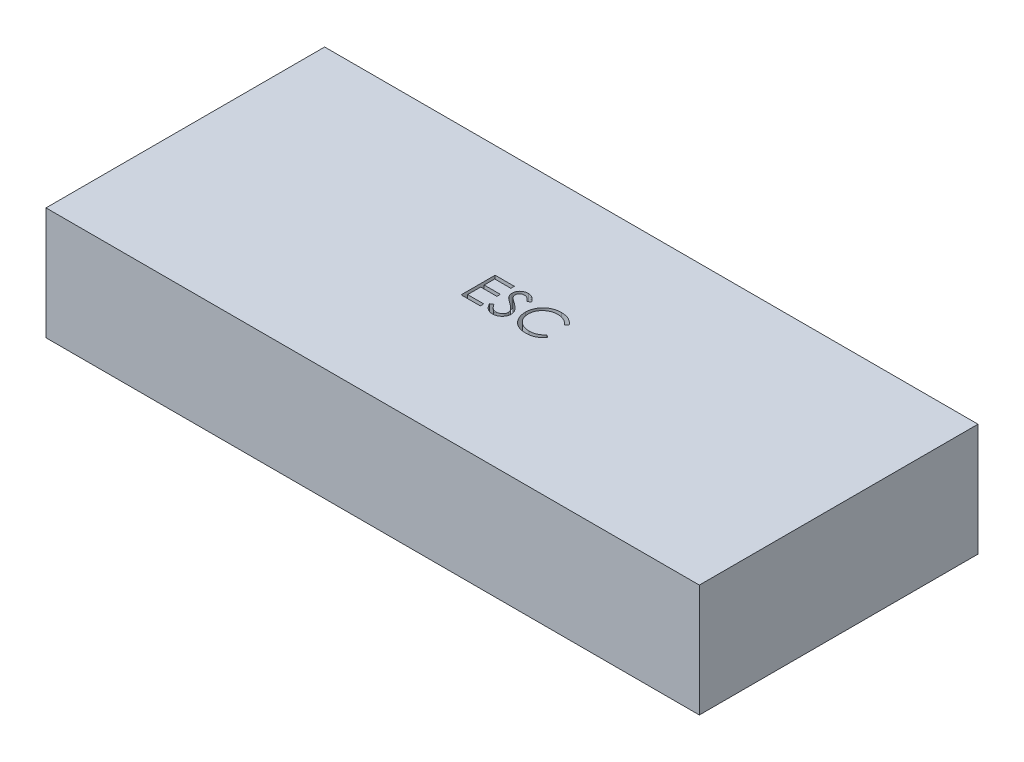
from build123d import *

# Parameters (mm, degrees)
SKETCH1_W           = 60.96
SKETCH1_H           = 25.999948
BOSS_EXTRUDE1_DEPTH = 10.5000044
CUT_EXTRUDE1_DEPTH  = 1.27


with BuildPart() as part:
    # Sketch1 → Boss-Extrude1 (new body)
    with BuildSketch(Plane(origin=(0, 0, 0), x_dir=(1, 0, 0), z_dir=(0, 1, 0))):
        Rectangle(SKETCH1_W, SKETCH1_H)
    extrude(amount=BOSS_EXTRUDE1_DEPTH)

    # Sketch2 → Cut-Extrude1 (cut)
    with BuildSketch(Plane(origin=(0, 10.5000044, 0), x_dir=(1, 0, 0), z_dir=(0, 1, 0))):
        Polygon((-4.08647315, 2.511822677), (-2.295447509, 2.511822677), (-2.295447509, 2.186181651), (-3.801537253, 2.186181651), (-3.801537253, 1.209258574), (-2.295447509, 1.209258574), (-2.295447509, 0.883617549), (-3.801537253, 0.883617549), (-3.801537253, -0.337536297), (-2.295447509, -0.337536297), (-2.295447509, -0.663177323), (-4.08647315, -0.663177323), align=None)
        with BuildLine():
            Line((-2.05121674, -0.050692347), (-1.782817301, 0.110220113))
            add(Edge.make_bspline(
                [(-1.782817301, 0.110220113), (-1.757854329, 0.068433135), (-1.710026237, -0.011629102), (-1.63024179, -0.119813181), (-1.54757122, -0.211763138), (-1.461402325, -0.28694406), (-1.372261072, -0.346134122), (-1.279565538, -0.388046146), (-1.183628095, -0.414186353), (-1.118337557, -0.417361431), (-1.085741981, -0.418946554)],
                knots=[0, 0, 0, 0, 1.272034388, 2.437168799, 3.508375237, 4.49857839, 5.41946034, 6.295179144, 7.148887113, 8, 8, 8, 8], degree=3))
            add(Edge.make_bspline(
                [(-1.085741981, -0.418946554), (-1.057904614, -0.418171244), (-1.00271697, -0.41663419), (-0.921471221, -0.401865176), (-0.842566301, -0.379175602), (-0.767628465, -0.3466809), (-0.697691729, -0.307366702), (-0.636362798, -0.259881241), (-0.583343824, -0.206717041), (-0.539974127, -0.147405632), (-0.506700095, -0.083617933), (-0.481125862, -0.018144035), (-0.466933545, 0.050044595), (-0.464795633, 0.095955515), (-0.46371674, 0.11912436)],
                knots=[0, 0, 0, 0, 1.095163259, 2.171163733, 3.241058638, 4.321873601, 5.38011039, 6.391990106, 7.366004449, 8.327778327, 9.272591725, 10.192022065, 11.087607919, 12, 12, 12, 12], degree=3))
            add(Edge.make_bspline(
                [(-0.46371674, 0.11912436), (-0.465054151, 0.145559273), (-0.467772911, 0.19929759), (-0.490752182, 0.278581561), (-0.526901141, 0.357042678), (-0.560250111, 0.405575969), (-0.577563896, 0.430772997)],
                knots=[0, 0, 0, 0, 0.938893495, 1.908633276, 2.914225137, 4, 4, 4, 4], degree=3))
            add(Edge.make_bspline(
                [(-0.577563896, 0.430772997), (-0.591779381, 0.44895833), (-0.621623015, 0.487136162), (-0.672928759, 0.54396434), (-0.733132306, 0.602582477), (-0.800173388, 0.665228907), (-0.876494118, 0.72898998), (-0.959704078, 0.796906203), (-1.051927721, 0.866394777), (-1.11660655, 0.912997033), (-1.149979761, 0.937043029)],
                knots=[0, 0, 0, 0, 0.722233717, 1.516239348, 2.393582979, 3.351407094, 4.387010283, 5.505090956, 6.712668013, 8, 8, 8, 8], degree=3))
            add(Edge.make_bspline(
                [(-1.149979761, 0.937043029), (-1.183384386, 0.960836105), (-1.247251486, 1.006326655), (-1.336567485, 1.073840112), (-1.416436391, 1.135565623), (-1.486503213, 1.192084262), (-1.546737133, 1.243403696), (-1.597612799, 1.289031113), (-1.637834204, 1.330200486), (-1.660200338, 1.356907989), (-1.670242181, 1.368898999)],
                knots=[0, 0, 0, 0, 1.452282411, 2.77665338, 3.964542531, 5.026858415, 5.96415736, 6.766646006, 7.446254459, 8, 8, 8, 8], degree=3))
            add(Edge.make_bspline(
                [(-1.670242181, 1.368898999), (-1.68427799, 1.387587082), (-1.711881292, 1.424339707), (-1.748317597, 1.481784399), (-1.779286694, 1.540588361), (-1.803563953, 1.60090961), (-1.824007523, 1.661901295), (-1.837757931, 1.724359211), (-1.846367984, 1.788003101), (-1.847249715, 1.83083249), (-1.847691099, 1.852272396)],
                knots=[0, 0, 0, 0, 1.068054152, 2.10047183, 3.106115577, 4.101338837, 5.06977816, 6.043150881, 7.020423561, 8, 8, 8, 8], degree=3))
            add(Edge.make_bspline(
                [(-1.847691099, 1.852272396), (-1.846507088, 1.885863692), (-1.844164374, 1.952328293), (-1.824351904, 2.049420546), (-1.793080065, 2.142118224), (-1.749269702, 2.229503599), (-1.692793389, 2.30930131), (-1.627437398, 2.382429259), (-1.549594122, 2.443905044), (-1.464184242, 2.49761884), (-1.37069739, 2.539661215), (-1.272734214, 2.571375818), (-1.170139012, 2.589345645), (-1.100649026, 2.591924439), (-1.065389416, 2.593232933)],
                knots=[0, 0, 0, 0, 1.005424448, 1.989358655, 2.955360095, 3.929531133, 4.905563448, 5.876582895, 6.856512386, 7.866279853, 8.892233794, 9.918561126, 10.94386622, 12, 12, 12, 12], degree=3))
            add(Edge.make_bspline(
                [(-1.065389416, 2.593232933), (-1.027975125, 2.591942476), (-0.953570042, 2.589376168), (-0.844123968, 2.567062693), (-0.738749604, 2.530141369), (-0.653983214, 2.488241658), (-0.587641351, 2.446393874), (-0.537047515, 2.40827589), (-0.485778114, 2.364392756), (-0.433419592, 2.314627583), (-0.380859137, 2.258523744), (-0.327316434, 2.196465476), (-0.272666276, 2.128832029), (-0.237509174, 2.080549804), (-0.219485971, 2.055798037)],
                knots=[0, 0, 0, 0, 1.286793592, 2.559021753, 3.825965368, 5.121522368, 5.803751409, 6.523245864, 7.299691795, 8.125521123, 9.008227632, 9.944561021, 10.946284179, 12, 12, 12, 12], degree=3))
            Line((-0.219485971, 2.055798037), (-0.47707311, 1.860540626))
            add(Edge.make_bspline(
                [(-0.47707311, 1.860540626), (-0.492626921, 1.880578223), (-0.522579922, 1.919165952), (-0.568054528, 1.973205645), (-0.610915802, 2.022569166), (-0.653143664, 2.065445389), (-0.692507887, 2.104182324), (-0.730714061, 2.137347247), (-0.767212366, 2.165265108), (-0.813219849, 2.195058909), (-0.871020922, 2.224592309), (-0.943578323, 2.249583258), (-1.019403015, 2.264601064), (-1.071046324, 2.266586698), (-1.097190298, 2.267591908)],
                knots=[0, 0, 0, 0, 1.181633172, 2.275549214, 3.290209073, 4.226197932, 5.078386478, 5.862611352, 6.581680152, 7.217281963, 8.414376989, 9.595101626, 10.782541182, 12, 12, 12, 12], degree=3))
            add(Edge.make_bspline(
                [(-1.097190298, 2.267591908), (-1.129989429, 2.266492723), (-1.193239463, 2.264373048), (-1.283037749, 2.241222776), (-1.363858667, 2.204772088), (-1.433302779, 2.153686358), (-1.491121323, 2.093160886), (-1.53294556, 2.023511496), (-1.558118924, 1.946601745), (-1.561190763, 1.892951814), (-1.562755202, 1.865628767)],
                knots=[0, 0, 0, 0, 1.14458467, 2.207223713, 3.21896685, 4.227309161, 5.202851033, 6.127160689, 7.046193047, 8, 8, 8, 8], degree=3))
            add(Edge.make_bspline(
                [(-1.562755202, 1.865628767), (-1.56239858, 1.848618497), (-1.561684753, 1.814570142), (-1.551729043, 1.764267781), (-1.538938938, 1.714092494), (-1.518670979, 1.664269866), (-1.490689882, 1.613928554), (-1.453945901, 1.562201692), (-1.407669539, 1.508633356), (-1.372221107, 1.473792382), (-1.353505402, 1.455397396)],
                knots=[0, 0, 0, 0, 0.858281714, 1.717966888, 2.583508476, 3.4729293, 4.427298488, 5.488583878, 6.674047936, 8, 8, 8, 8], degree=3))
            add(Edge.make_bspline(
                [(-1.353505402, 1.455397396), (-1.346555443, 1.449195237), (-1.33004393, 1.434460327), (-1.299857912, 1.410337329), (-1.259995517, 1.380580529), (-1.211497663, 1.343762035), (-1.153470127, 1.301052423), (-1.08590653, 1.252997789), (-1.009559997, 1.198038122), (-0.955383687, 1.159613782), (-0.926737574, 1.139296635)],
                knots=[0, 0, 0, 0, 0.420754252, 0.999615792, 1.744751191, 2.668019286, 3.750313428, 4.999500688, 6.413464383, 8, 8, 8, 8], degree=3))
            add(Edge.make_bspline(
                [(-0.926737574, 1.139296635), (-0.892278924, 1.114221973), (-0.825554524, 1.065668366), (-0.730615148, 0.992719856), (-0.644532908, 0.921375095), (-0.567005573, 0.852089694), (-0.497267235, 0.78538921), (-0.436091588, 0.720471182), (-0.382855292, 0.657800698), (-0.325542715, 0.577452719), (-0.266979551, 0.478772735), (-0.216686183, 0.357870333), (-0.184973968, 0.236497956), (-0.18082695, 0.154921469), (-0.178780843, 0.114672236)],
                knots=[0, 0, 0, 0, 1.163667725, 2.253281268, 3.268753668, 4.215851969, 5.092017293, 5.902905408, 6.650798638, 7.335211899, 8.59617414, 9.77448103, 10.901945474, 12, 12, 12, 12], degree=3))
            add(Edge.make_bspline(
                [(-0.178780843, 0.114672236), (-0.179376961, 0.086207576), (-0.180557621, 0.029831021), (-0.194129307, -0.05295037), (-0.214013575, -0.13335123), (-0.243983066, -0.210377739), (-0.280561931, -0.28543906), (-0.326977027, -0.356566227), (-0.380777569, -0.42533346), (-0.442493913, -0.489907055), (-0.510026982, -0.54918539), (-0.581404333, -0.601916753), (-0.656742795, -0.645884446), (-0.735633668, -0.68176271), (-0.818095074, -0.70982383), (-0.904099278, -0.730155504), (-0.993788049, -0.742633899), (-1.054748485, -0.743929082), (-1.085741981, -0.74458758)],
                knots=[0, 0, 0, 0, 0.983748083, 1.948392443, 2.894712957, 3.844097841, 4.80183111, 5.778335162, 6.776009319, 7.81870978, 8.863265674, 9.881300176, 10.883814829, 11.87499822, 12.874611388, 13.892143829, 14.928324115, 16, 16, 16, 16], degree=3))
            add(Edge.make_bspline(
                [(-1.085741981, -0.74458758), (-1.109722613, -0.744123865), (-1.157381867, -0.743202275), (-1.227875468, -0.735054971), (-1.296944953, -0.723527813), (-1.363723623, -0.705227049), (-1.429071846, -0.683022934), (-1.492705409, -0.655683161), (-1.554655151, -0.6229197), (-1.615268244, -0.585459213), (-1.674390531, -0.541863974), (-1.731467477, -0.491088016), (-1.788371809, -0.434531737), (-1.843423947, -0.370659297), (-1.897737443, -0.300502607), (-1.950241428, -0.223405277), (-2.002022701, -0.139787249), (-2.034512447, -0.08094535), (-2.05121674, -0.050692347)],
                knots=[0, 0, 0, 0, 0.915332311, 1.819136955, 2.706846663, 3.586547465, 4.459518054, 5.340707479, 6.227863349, 7.133153174, 8.059268498, 9.028702269, 10.047606654, 11.120612155, 12.245963614, 13.433783089, 14.680604001, 16, 16, 16, 16], degree=3))
        make_face()
        with BuildLine():
            Line((3.403270439, 1.929230529), (3.153951529, 1.738425241))
            add(Edge.make_bspline(
                [(3.153951529, 1.738425241), (3.136166187, 1.759621514), (3.100835289, 1.801728287), (3.043994441, 1.860855445), (2.984756522, 1.916250361), (2.923144177, 1.968176923), (2.858048404, 2.014819275), (2.791046108, 2.058608061), (2.721016453, 2.097858081), (2.624177379, 2.145449504), (2.497496831, 2.195112087), (2.338025799, 2.236752876), (2.171555016, 2.263260657), (2.057982908, 2.26613162), (2.000215551, 2.267591908)],
                knots=[0, 0, 0, 0, 0.757959112, 1.505699292, 2.245454638, 2.979532153, 3.711538275, 4.438200793, 5.171680507, 5.909471876, 7.393775596, 8.890124382, 10.418191784, 12, 12, 12, 12], degree=3))
            add(Edge.make_bspline(
                [(2.000215551, 2.267591908), (1.968389987, 2.267225456), (1.90503423, 2.266495954), (1.811010257, 2.256871961), (1.718741989, 2.243345364), (1.628289445, 2.223274535), (1.539767761, 2.197899373), (1.452598225, 2.167577748), (1.368042895, 2.130063), (1.284932065, 2.088599079), (1.205303781, 2.041765611), (1.129960987, 1.990681356), (1.059178473, 1.935917961), (0.992900247, 1.877270172), (0.931058551, 1.815002108), (0.87410149, 1.748450169), (0.822226154, 1.677827126), (0.774404281, 1.604064249), (0.731575587, 1.527376396), (0.695716339, 1.447479725), (0.663961693, 1.365742431), (0.638834523, 1.281241021), (0.618945854, 1.194570083), (0.605222902, 1.105497011), (0.595708361, 1.014207888), (0.594982486, 0.952332297), (0.594616593, 0.921142589)],
                knots=[0, 0, 0, 0, 1.054917814, 2.100044995, 3.131103042, 4.146048494, 5.169673617, 6.183595914, 7.203665975, 8.234915748, 9.262203917, 10.264457458, 11.251630812, 12.227803204, 13.197192746, 14.159520551, 15.12972552, 16.100847026, 17.073214652, 18.039054194, 19.002613845, 19.979014051, 20.95965708, 21.949030935, 22.966165397, 24, 24, 24, 24], degree=3))
            add(Edge.make_bspline(
                [(0.594616593, 0.921142589), (0.595761243, 0.874214891), (0.598008612, 0.782078582), (0.618009601, 0.647122386), (0.648403505, 0.517835774), (0.693956207, 0.395026917), (0.750125631, 0.277181478), (0.821101043, 0.166293376), (0.903303188, 0.060686921), (0.997894983, -0.037142039), (1.101677401, -0.126508061), (1.213027293, -0.205203232), (1.331667325, -0.270803161), (1.456287554, -0.325391341), (1.587846957, -0.367352801), (1.726108957, -0.396893113), (1.870772838, -0.416162805), (1.969623651, -0.418007651), (2.019932098, -0.418946554)],
                knots=[0, 0, 0, 0, 1.029171465, 2.020641659, 2.987623507, 3.938342917, 4.889210282, 5.84687017, 6.821220943, 7.821438502, 8.827599549, 9.822697543, 10.807740252, 11.797342354, 12.80366471, 13.83203677, 14.896651826, 16, 16, 16, 16], degree=3))
            add(Edge.make_bspline(
                [(2.019932098, -0.418946554), (2.075360966, -0.417414589), (2.184458237, -0.414399317), (2.344449233, -0.388854855), (2.497607392, -0.347436601), (2.643940952, -0.289472057), (2.783037381, -0.214119975), (2.915114352, -0.122772614), (3.040283348, -0.014561055), (3.115550154, 0.068064354), (3.153951529, 0.110220113)],
                knots=[0, 0, 0, 0, 1.028121516, 2.023589091, 2.998037872, 3.967518031, 4.937445131, 5.927275754, 6.942489185, 8, 8, 8, 8], degree=3))
            Line((3.153951529, 0.110220113), (3.403270439, -0.078677123))
            add(Edge.make_bspline(
                [(3.403270439, -0.078677123), (3.383206154, -0.104565576), (3.34317369, -0.156218477), (3.27835106, -0.229036385), (3.210063798, -0.297529332), (3.137804689, -0.361145102), (3.062404978, -0.421156653), (2.982510809, -0.475859029), (2.899172473, -0.526015759), (2.812672338, -0.571941612), (2.723102311, -0.612687972), (2.630569716, -0.647571033), (2.535473408, -0.67762004), (2.43780904, -0.70234144), (2.337374032, -0.721637351), (2.234530816, -0.734536628), (2.12905743, -0.743373936), (2.057899855, -0.744179403), (2.021840151, -0.74458758)],
                knots=[0, 0, 0, 0, 0.986787822, 1.968848986, 2.935600012, 3.899624008, 4.868462664, 5.837806735, 6.815139263, 7.798259679, 8.787526145, 9.778297419, 10.776456485, 11.791383307, 12.812564526, 13.85620153, 14.913611965, 16, 16, 16, 16], degree=3))
            add(Edge.make_bspline(
                [(2.021840151, -0.74458758), (1.987691967, -0.744349915), (1.920168163, -0.743879962), (1.820474295, -0.736267068), (1.723419461, -0.725880521), (1.62928105, -0.710241259), (1.537545344, -0.691786036), (1.449043957, -0.66704711), (1.362906016, -0.639334652), (1.279477593, -0.6067637), (1.198687722, -0.570009734), (1.120796979, -0.528470249), (1.045841187, -0.482494557), (0.973083412, -0.433096083), (0.903598461, -0.378688102), (0.836784192, -0.320026227), (0.772265946, -0.257308174), (0.732349224, -0.2120827), (0.712279854, -0.18934419)],
                knots=[0, 0, 0, 0, 1.114604814, 2.203992996, 3.262667896, 4.300477797, 5.318619304, 6.316056647, 7.298880507, 8.271930387, 9.238335007, 10.195173496, 11.151986948, 12.108099108, 13.064862484, 14.031167946, 15.010108607, 16, 16, 16, 16], degree=3))
            add(Edge.make_bspline(
                [(0.712279854, -0.18934419), (0.680134663, -0.149846112), (0.616232367, -0.07132681), (0.534475497, 0.055932616), (0.464491643, 0.188800205), (0.407907772, 0.327973998), (0.363673007, 0.473141699), (0.333028637, 0.624376487), (0.313115396, 0.781537121), (0.310838205, 0.888431922), (0.309680696, 0.942767188)],
                knots=[0, 0, 0, 0, 0.994628077, 1.977248131, 2.950237994, 3.925870899, 4.908910175, 5.911660606, 6.938484602, 8, 8, 8, 8], degree=3))
            add(Edge.make_bspline(
                [(0.309680696, 0.942767188), (0.311091478, 0.999876778), (0.313867105, 1.112236331), (0.337449006, 1.277131274), (0.375384628, 1.435111472), (0.429266091, 1.585882012), (0.497578803, 1.730235909), (0.581967231, 1.86707043), (0.681450996, 1.99726067), (0.795249861, 2.118831194), (0.920043086, 2.229991893), (1.053682296, 2.327787521), (1.195905919, 2.409174124), (1.345147113, 2.477206357), (1.50252341, 2.52949812), (1.667699038, 2.566104225), (1.840363625, 2.588889038), (1.958167397, 2.591769405), (2.018024045, 2.593232933)],
                knots=[0, 0, 0, 0, 1.032925535, 2.032216505, 3.007276963, 3.968222605, 4.92396291, 5.891752235, 6.871517503, 7.883894988, 8.900124299, 9.891468569, 10.874487609, 11.85992873, 12.854644235, 13.869047385, 14.917252991, 16, 16, 16, 16], degree=3))
            add(Edge.make_bspline(
                [(2.018024045, 2.593232933), (2.054504316, 2.592795565), (2.126713339, 2.591929839), (2.233531816, 2.583487838), (2.337528784, 2.569414781), (2.438775889, 2.550259489), (2.537765691, 2.526485705), (2.633741624, 2.495515577), (2.727266861, 2.460103867), (2.817751557, 2.419320115), (2.90476157, 2.373539571), (2.988269802, 2.323269684), (3.067612924, 2.268572775), (3.143349236, 2.209914037), (3.214211799, 2.146052487), (3.282212569, 2.078744668), (3.345042261, 2.006051842), (3.383825517, 1.954884509), (3.403270439, 1.929230529)],
                knots=[0, 0, 0, 0, 1.096760587, 2.17092713, 3.219439832, 4.250915756, 5.268269357, 6.278326846, 7.281116186, 8.274029601, 9.260640565, 10.235837813, 11.203064059, 12.156899882, 13.114053108, 14.069676657, 15.032185724, 16, 16, 16, 16], degree=3))
        make_face()
    extrude(amount=-CUT_EXTRUDE1_DEPTH, mode=Mode.SUBTRACT)


solid = part.part
